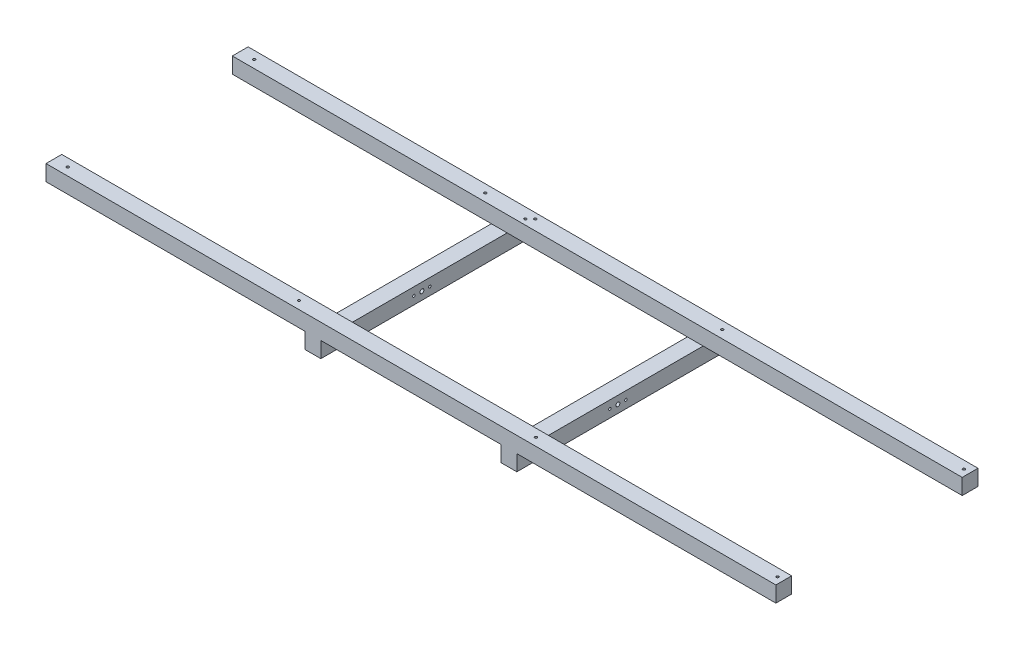
from build123d import *

# Parameters (mm, degrees)
ESBO_O1_W                  = 31.7
ESBO_O1_H                  = 405.7
RESSALTO_EXTRUS_O1_DEPTH   = 31.7
RESSALTO_EXTRUS_O1_2_DEPTH = 31.7
ESBO_O3_W                  = 1465.1
ESBO_O3_H                  = 31.7
RESSALTO_EXTRUS_O2_DEPTH   = 31.7
ESBO_O4_R                  = 2.5
CORTE_EXTRUS_O2_DEPTH      = 31.7
CORTE_EXTRUS_O3_DEPTH      = 761.777572619
CORTE_EXTRUS_O3_DEPTH_BACK = 761.777572619
ESBO_O5_R                  = 2.5
ESBO_O5_R_2                = 4


with BuildPart() as part:
    # Esboço1 → Ressalto-extrusão1 (new body)
    with BuildSketch(Plane(origin=(0, 0, 0), x_dir=(1, 0, 0), z_dir=(0, 1, 0))):
        with Locations((-196.7, 0)):
            Rectangle(ESBO_O1_W, ESBO_O1_H)
    extrude(amount=-RESSALTO_EXTRUS_O1_DEPTH)



with BuildPart() as body_2:
    # Esboço1 → Ressalto-extrus_o1 2 (new body)
    with BuildSketch(Plane(origin=(0, 0, 0), x_dir=(1, 0, 0), z_dir=(0, 1, 0))):
        with Locations((196.7, 0)):
            Rectangle(ESBO_O1_W, ESBO_O1_H)
    extrude(amount=-RESSALTO_EXTRUS_O1_2_DEPTH)


with BuildPart() as part_1:
    add(part.part)

    add(body_2.part)  # Ressalto-extrusão2 merges body 2
    # Esboço3 → Ressalto-extrusão2 (add)
    with BuildSketch(Plane(origin=(0, 0, 0), x_dir=(1, 0, 0), z_dir=(0, 1, 0))):
        with Locations((0, 187)):
            Rectangle(ESBO_O3_W, ESBO_O3_H)
        with Locations((0, -187)):
            Rectangle(ESBO_O3_W, ESBO_O3_H)
    extrude(amount=RESSALTO_EXTRUS_O2_DEPTH)

    # Esboço4 → Corte-extrusão2 (cut)
    with BuildSketch(Plane(origin=(0, 0, 0), x_dir=(1, 0, 0), z_dir=(0, 1, 0))):
        with Locations(Location((720, 187, 0), (0, 0, 270))):
            Circle(ESBO_O4_R)
        with Locations(Location((720, -187, 0), (0, 0, 270))):
            Circle(ESBO_O4_R)
        with Locations(Location((235.05, 187, 0), (0, 0, 270))):
            Circle(ESBO_O4_R)
        with Locations(Location((235.05, -187, 0), (0, 0, 270))):
            Circle(ESBO_O4_R)
        with Locations(Location((-704.55, 187, 0), (0, 0, 270))):
            Circle(ESBO_O4_R)
        with Locations(Location((-704.55, -187, 0), (0, 0, 270))):
            Circle(ESBO_O4_R)
        with Locations(Location((-240.55, 187, 0), (0, 0, 270))):
            Circle(ESBO_O4_R)
        with Locations(Location((-240.55, -187, 0), (0, 0, 270))):
            Circle(ESBO_O4_R)
        with Locations(Location((-155, 182, 0), (0, 0, 270))):
            Circle(ESBO_O4_R)
        with Locations(Location((-145, 192, 0), (0, 0, 270))):
            Circle(ESBO_O4_R)
    extrude(amount=CORTE_EXTRUS_O2_DEPTH, mode=Mode.SUBTRACT)

    # Esboço5 → Corte-extrusão3 (cut, two sides: drawn at the far end of the back side and taken through both)
    with BuildSketch(Plane(origin=(0, 0, 0), x_dir=(0, 0, -1), z_dir=(1, 0, 0)).offset(-CORTE_EXTRUS_O3_DEPTH_BACK)):
        with Locations((16, -15.85)):
            Circle(ESBO_O5_R)
        with Locations((-16, -15.85)):
            Circle(ESBO_O5_R)
        with Locations((0, -15.85)):
            Circle(ESBO_O5_R_2)
    extrude(amount=CORTE_EXTRUS_O3_DEPTH + CORTE_EXTRUS_O3_DEPTH_BACK, mode=Mode.SUBTRACT)


solid = part_1.part
